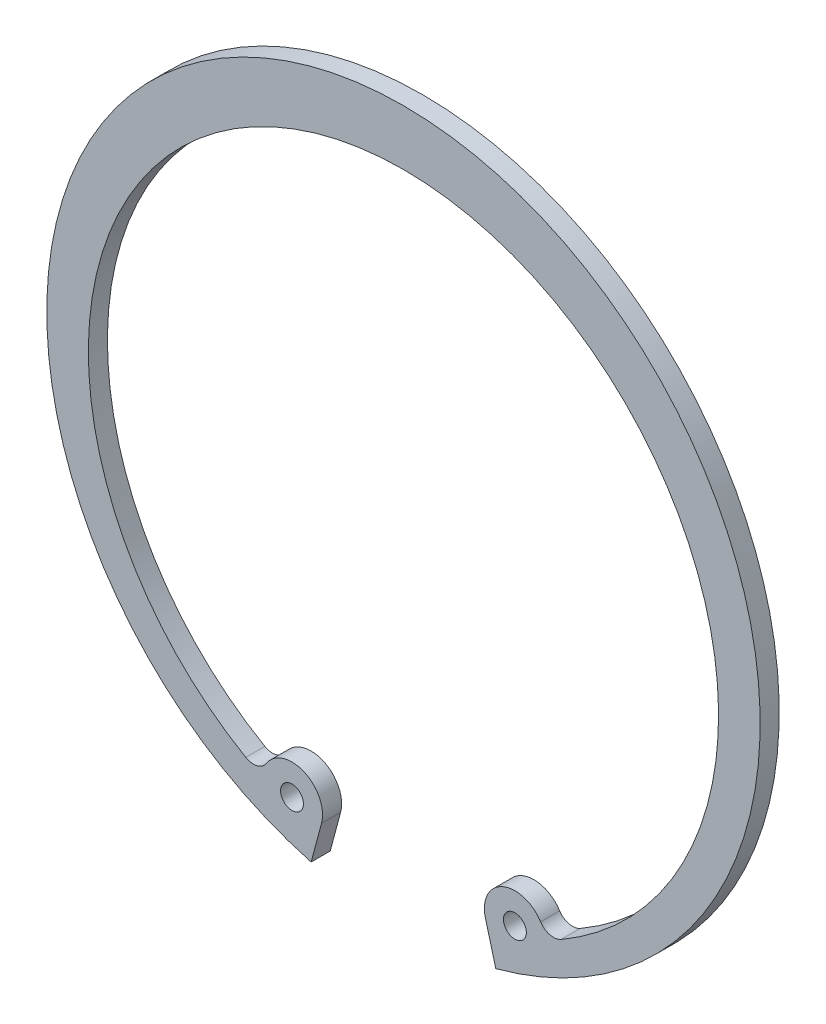
from build123d import *

# Parameters (mm, degrees)
SKETCH1_R  = 1.5
BODY_DEPTH = 2.5


with BuildPart() as part:
    # Sketch1 → Body (new body)
    with BuildSketch(Plane.XY):
        with BuildLine():
            Line((10.7429859, -40.093369202), (12.099790359, -45.157032379))
            ThreePointArc((12.099790359, -45.157032379), (0, 46.75), (-12.099790359, -45.157032379))
            Line((-12.099790359, -45.157032379), (-10.7429859, -40.093369202))
            ThreePointArc((-10.7429859, -40.093369202), (-12.9932333, -35.397934549), (-17.977352649, -36.904345602))
            ThreePointArc((-17.977352649, -36.904345602), (-19.18898515, -37.770564542), (-20.663329885, -37.559149851))
            ThreePointArc((-20.663329885, -37.559149851), (0, 39.5), (20.663329885, -37.559149851))
            ThreePointArc((20.663329885, -37.559149851), (19.18898515, -37.770564542), (17.977352649, -36.904345602))
            ThreePointArc((17.977352649, -36.904345602), (12.9932333, -35.397934549), (10.7429859, -40.093369202))
        make_face()
        with Locations(Location((14.606689205, -39.058093022, 0), (0, 0, 180))):
            Circle(SKETCH1_R, mode=Mode.SUBTRACT)
        with Locations((-14.606689205, -39.058093022)):
            Circle(SKETCH1_R, mode=Mode.SUBTRACT)
    extrude(amount=-BODY_DEPTH)


solid = part.part
